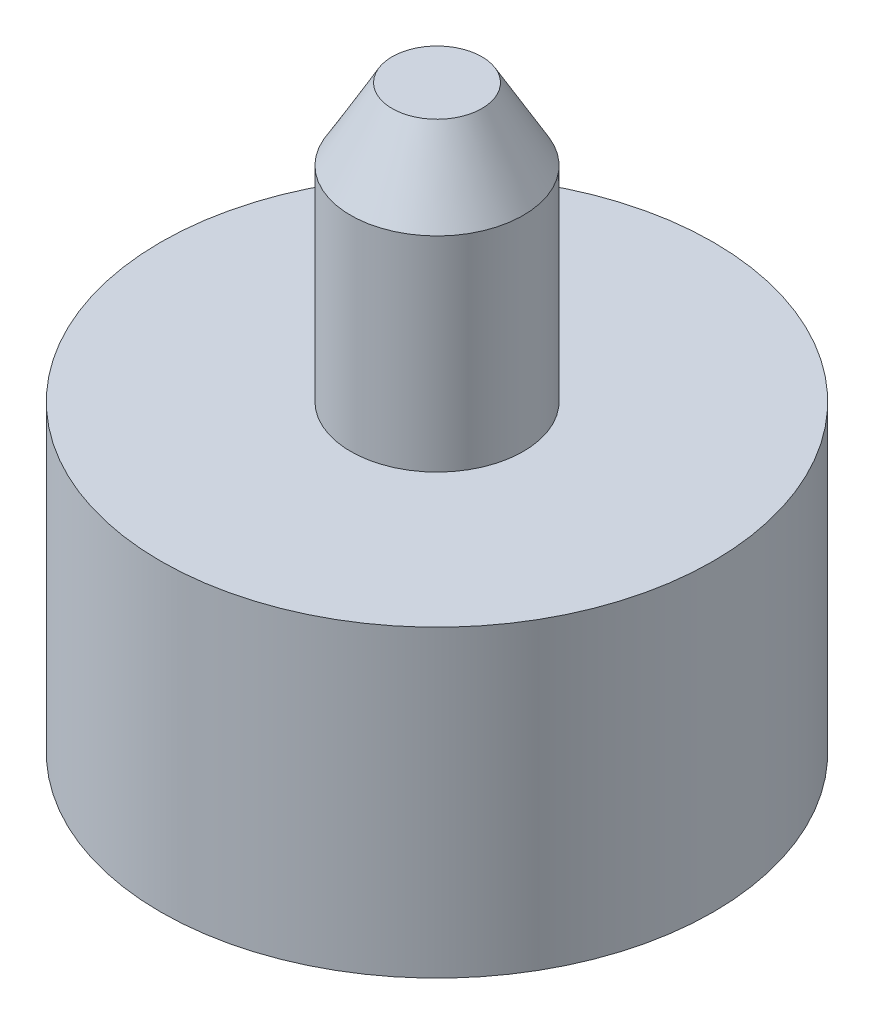
from build123d import *

# Parameters (mm, degrees)
SKETCH_1_R      = 40
EXTRUDE_1_DEPTH = 44
SKETCH_3_R      = 12.5
EXTRUDE_2_DEPTH = 84
CHAMFER_1_SIZE  = 6
CHAMFER_1_SIZE2 = 10.392304845


with BuildPart() as part:
    # 草图1 → 凸台-拉伸1 (new body)
    with BuildSketch(Plane(origin=(0, 0, 0), x_dir=(1, 0, 0), z_dir=(0, 1, 0))):
        with Locations(Location((0, 0, 0), (0, 0, 270))):
            Circle(SKETCH_1_R)
    extrude(amount=EXTRUDE_1_DEPTH)

    # 草图3 → 凸台-拉伸2 (add)
    with BuildSketch(Plane.XZ):
        with Locations(Location((0, 0, 0), (0, 0, 270))):
            Circle(SKETCH_3_R)
    extrude(amount=-EXTRUDE_2_DEPTH)

    # 倒角1
    chamfer_1_edges = [part.edges().sort_by_distance(p)[0] for p in [
        (0, 84, 12.5),
    ]]
    chamfer_1_side = [part.faces().sort_by_distance(p)[0] for p in [
        (0, 84, 0),
    ]]
    chamfer(chamfer_1_edges, length=CHAMFER_1_SIZE, length2=CHAMFER_1_SIZE2, reference=chamfer_1_side[0])


solid = part.part
